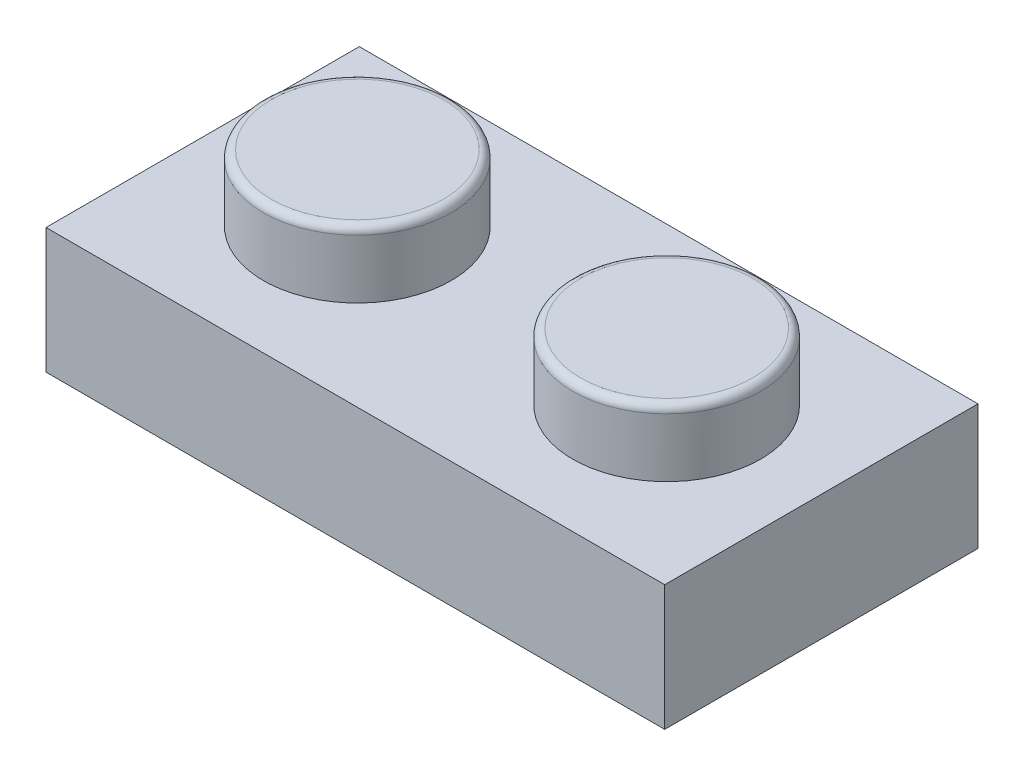
from build123d import *

# Parameters (mm, degrees)
ESQUISSE1_W             = 15.8
ESQUISSE1_H             = 8
BOSS_EXTRU_1_DEPTH      = 3.2
ESQUISSE2_R             = 2.4
BOSS_EXTRU_2_DEPTH      = 1.7
ESQUISSE3_R             = 1.9
ENL_V_MAT_EXTRU_1_DEPTH = 1.7
CONG_1_R                = 0.2


with BuildPart() as part:
    # Esquisse1 → Boss.-Extru.1 (new body)
    with BuildSketch(Plane(origin=(0, 0, 0), x_dir=(1, 0, 0), z_dir=(0, 1, 0))):
        with Locations((7.9, 4)):
            Rectangle(ESQUISSE1_W, ESQUISSE1_H)
    extrude(amount=BOSS_EXTRU_1_DEPTH)

    # Esquisse2 → Boss.-Extru.2 (add)
    with BuildSketch(Plane(origin=(0, 3.2, 0), x_dir=(1, 0, 0), z_dir=(0, 1, 0))):
        with Locations(Location((3.95, 4, 0), (0, 0, 90))):
            Circle(ESQUISSE2_R)
        with Locations(Location((11.85, 4, 0), (0, 0, 90))):
            Circle(ESQUISSE2_R)
    extrude(amount=BOSS_EXTRU_2_DEPTH)

    # Esquisse3 → Enlèv. mat.-Extru.1 (cut)
    with BuildSketch(Plane.XZ):
        with Locations(Location((3.95, -4, 0), (0, 0, 270))):
            Circle(ESQUISSE3_R)
        with Locations(Location((11.85, -4, 0), (0, 0, 270))):
            Circle(ESQUISSE3_R)
    extrude(amount=-ENL_V_MAT_EXTRU_1_DEPTH, mode=Mode.SUBTRACT)

    # Congé1
    cong_1_edges = [part.edges().sort_by_distance(p)[0] for p in [
        (3.95, 4.9, -1.6),
        (11.85, 4.9, -1.6),
        (3.95, 1.7, -2.1),
        (11.85, 1.7, -2.1),
    ]]
    fillet(cong_1_edges, radius=CONG_1_R)


solid = part.part
